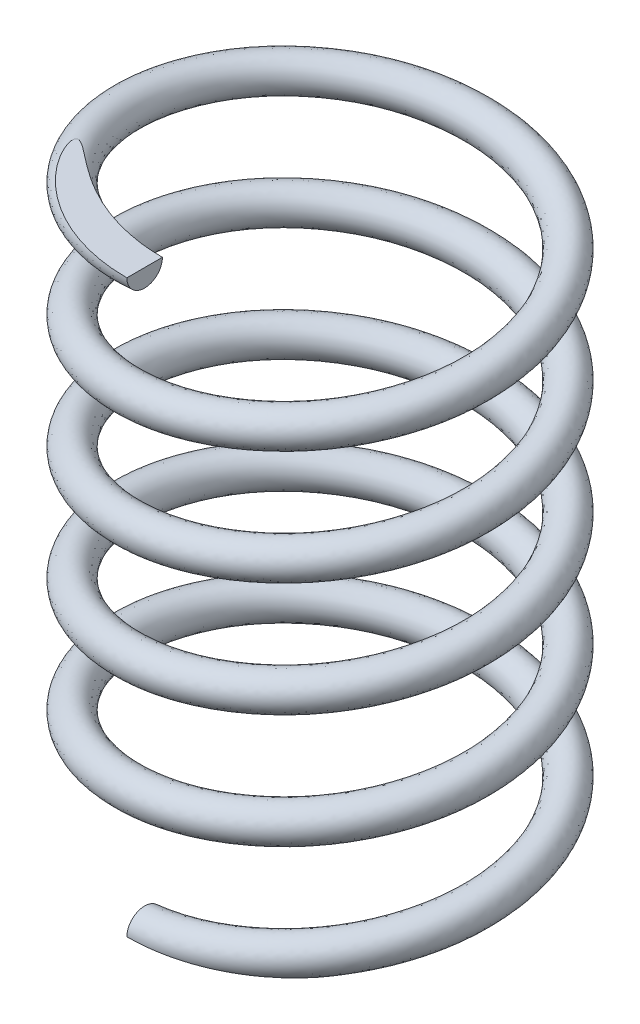
from build123d import *

# Parameters (mm, degrees)
SWEEP_1_PITCH  = 2.6
SWEEP_1_HEIGHT = 13
SWEEP_1_RADIUS = 4.4
SKETCH_2_R     = 0.405


with BuildPart() as part:
    # По траектории1: sweep along a helix
    with BuildLine() as sweep_1_path:
        Helix(SWEEP_1_PITCH, SWEEP_1_HEIGHT, SWEEP_1_RADIUS, center=(0, 0, 0), direction=(0, 1, 0))
    # Эскиз2 → По траектории1 (sweep)
    with BuildSketch(Plane(origin=(0, 0, 0), x_dir=(0, 0, -1), z_dir=(1, 0, 0))):
        with Locations((-3.995, 0)):
            Circle(SKETCH_2_R)
    sweep(path=sweep_1_path.line, is_frenet=True)

    # Surface Cut 1
    split(bisect_by=Plane(origin=(0, 0, 0), x_dir=(1, 0, 0), z_dir=(0, 1, 0)), keep=Keep.TOP)

    # Surface Cut 2
    split(bisect_by=Plane(origin=(0, 13, 0), x_dir=(1, 0, 0), z_dir=(0, 1, 0)), keep=Keep.BOTTOM)


solid = part.part
